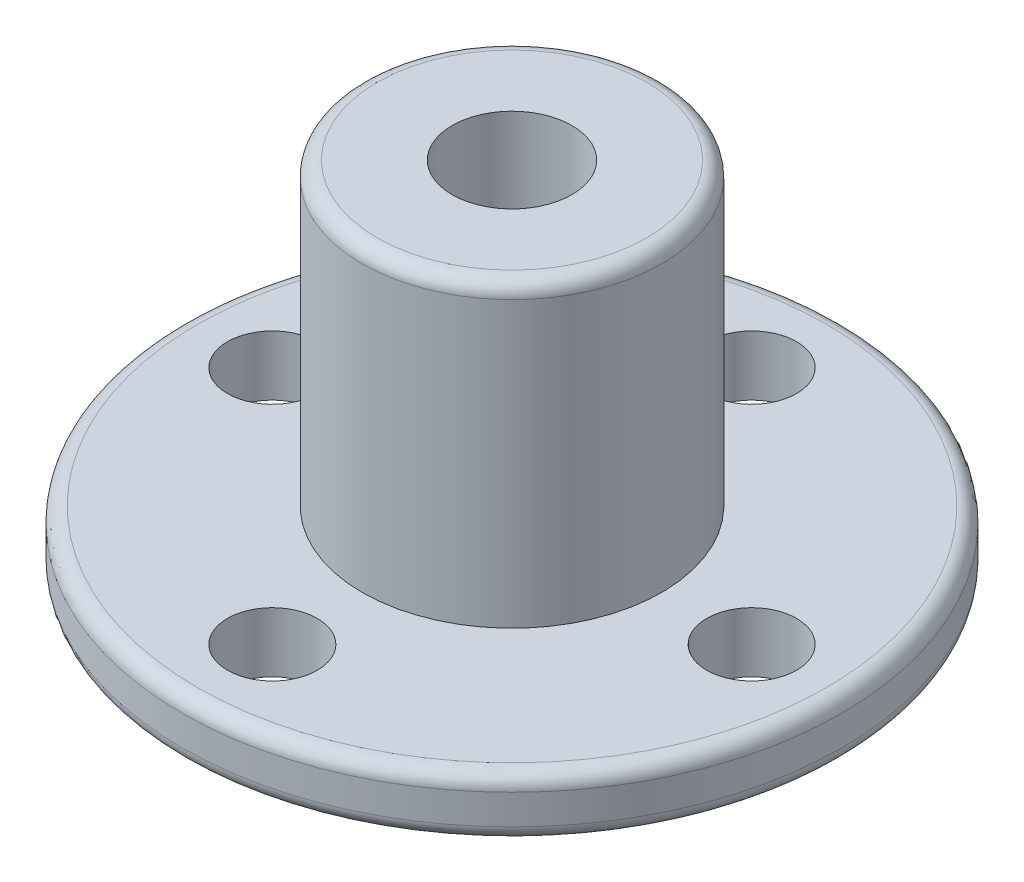
from build123d import *

# Parameters (mm, degrees)
SKETCH_1_R               = 11
EXTRUDE_1_DEPTH          = 2
SKETCH_2_R               = 1.5
CUT_EXTRUDE_1_DEPTH      = 2
SKETCH_3_R               = 5
EXTRUDE_2_DEPTH          = 10
SKETCH_4_R               = 2
CUT_EXTRUDE_2_DEPTH      = 12
FILLET_1_R               = 0.5
CUT_EXTRUDE_3_REACH      = 21.647
CUT_EXTRUDE_3_END_RADIUS = 5
SKETCH_5_R               = 1.5


with BuildPart() as part:
    # 草图1 → 凸台-拉伸1 (new body)
    with BuildSketch(Plane(origin=(0, 0, 0), x_dir=(1, 0, 0), z_dir=(0, 1, 0))):
        with Locations(Location((0, 0, 0), (0, 0, 270))):
            Circle(SKETCH_1_R)
    extrude(amount=EXTRUDE_1_DEPTH)

    # 草图2 → 切除-拉伸1 (cut)
    with BuildSketch(Plane(origin=(0, 2, 0), x_dir=(1, 0, 0), z_dir=(0, 1, 0))):
        with Locations(Location((0, 8, 0), (0, 0, 270))):
            Circle(SKETCH_2_R)
        with Locations(Location((8, 0, 0), (0, 0, 270))):
            Circle(SKETCH_2_R)
        with Locations(Location((0, -8, 0), (0, 0, 270))):
            Circle(SKETCH_2_R)
        with Locations(Location((-8, 0, 0), (0, 0, 270))):
            Circle(SKETCH_2_R)
    extrude(amount=-CUT_EXTRUDE_1_DEPTH, mode=Mode.SUBTRACT)

    # 草图3 → 凸台-拉伸2 (add)
    with BuildSketch(Plane(origin=(0, 2, 0), x_dir=(1, 0, 0), z_dir=(0, 1, 0))):
        with Locations(Location((0, 0, 0), (0, 0, 270))):
            Circle(SKETCH_3_R)
    extrude(amount=EXTRUDE_2_DEPTH)

    # 草图4 → 切除-拉伸2 (cut)
    with BuildSketch(Plane(origin=(0, 12, 0), x_dir=(1, 0, 0), z_dir=(0, 1, 0))):
        with Locations(Location((0, 0, 0), (0, 0, 270))):
            Circle(SKETCH_4_R)
    extrude(amount=-CUT_EXTRUDE_2_DEPTH, mode=Mode.SUBTRACT)

    # 圆角1
    fillet_1_edges = [part.edges().sort_by_distance(p)[0] for p in [
        (0, 0, -11),
        (0, 12, -5),
        (0, 2, -11),
    ]]
    fillet(fillet_1_edges, radius=FILLET_1_R)

    # 切除-拉伸3: up to this cylinder (the profile starts inside it)
    cut_extrude_3_end = Plane(origin=(0, 7, 0), z_dir=(0, -1, 0)) * Cylinder(CUT_EXTRUDE_3_END_RADIUS, 54.294, mode=Mode.PRIVATE)
    # 草图5 → 切除-拉伸3 (cut, up to the surface)
    with BuildSketch(Plane.XY, mode=Mode.PRIVATE) as cut_extrude_3_sk1:
        with Locations((0, 7)):
            Circle(SKETCH_5_R)
    cut_extrude_3_tool1 = extrude(cut_extrude_3_sk1.sketch, amount=-CUT_EXTRUDE_3_REACH, mode=Mode.PRIVATE) & cut_extrude_3_end
    add(cut_extrude_3_tool1.solids().sort_by_distance((0, 7, 0))[0], mode=Mode.SUBTRACT)


solid = part.part
